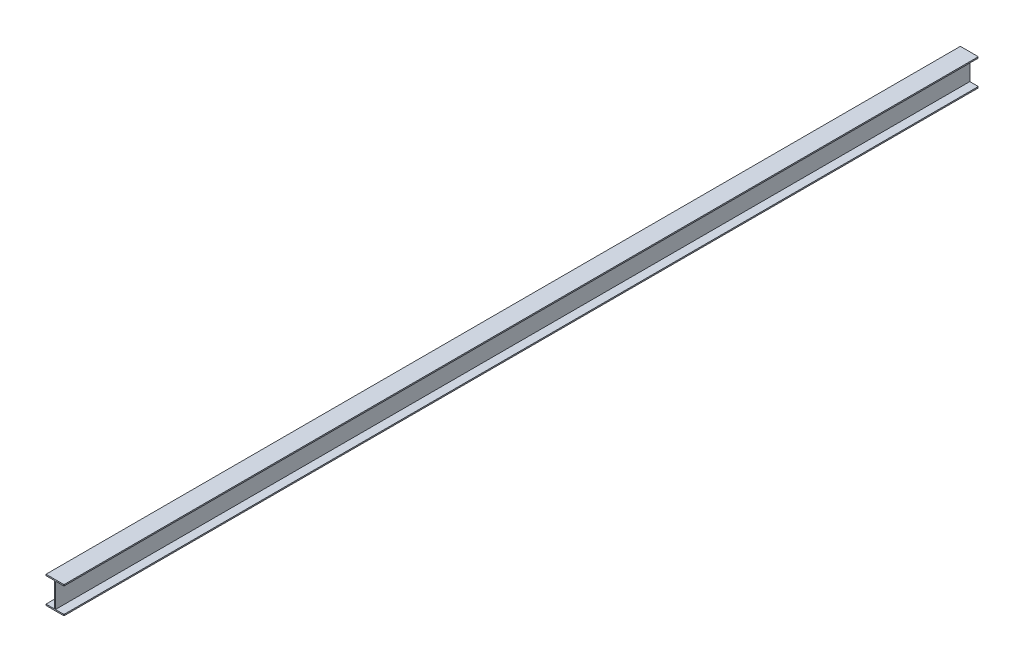
from build123d import *

# Parameters (mm, degrees)
BOSS_EXTRUDE1_DEPTH = 5168.81608
FILLET1_R           = 3.175


with BuildPart() as part:
    # Sketch1 → Boss-Extrude1 (new body)
    with BuildSketch(Plane.XY):
        Polygon((0, -0.000240533), (101.6, -0.000240533), (101.6, -7.112240533), (53.408035714, -7.112240533), (53.408035714, -146.050240533), (101.6, -146.050240533), (101.6, -153.162240533), (0, -153.162240533), (0, -146.050240533), (47.566035714, -146.050240533), (47.566035714, -7.112240533), (0, -7.112240533), align=None)
    extrude(amount=BOSS_EXTRUDE1_DEPTH)

    # Fillet1
    fillet1_edges = [part.edges().sort_by_distance(p)[0] for p in [
        (101.6, -3.556240533, 0),
        (101.6, -149.606240533, 0),
        (101.6, -149.606240533, 5168.81608),
        (101.6, -3.556240533, 5168.81608),
    ]]
    fillet(fillet1_edges, radius=FILLET1_R)


solid = part.part
